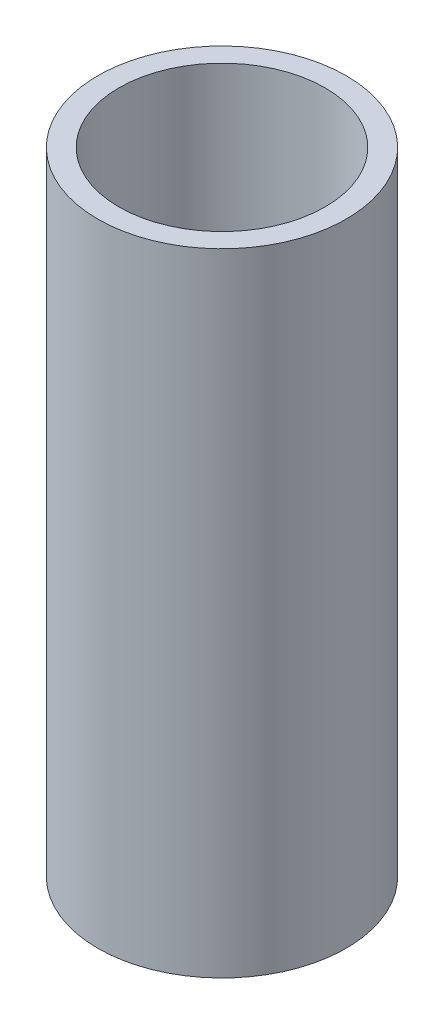
from build123d import *

# Parameters (mm, degrees)
SKETCH1_R           = 29.5
SKETCH1_R_2         = 24.5
BOSS_EXTRUDE1_DEPTH = 150


with BuildPart() as part:
    # Sketch1 → Boss-Extrude1 (new body)
    with BuildSketch(Plane(origin=(0, 0, 0), x_dir=(1, 0, 0), z_dir=(0, 1, 0))):
        with Locations(Location((0, 0, 0), (0, 0, 270))):
            Circle(SKETCH1_R)
        with Locations(Location((0, 0, 0), (0, 0, 270))):
            Circle(SKETCH1_R_2, mode=Mode.SUBTRACT)
    extrude(amount=BOSS_EXTRUDE1_DEPTH)


solid = part.part
